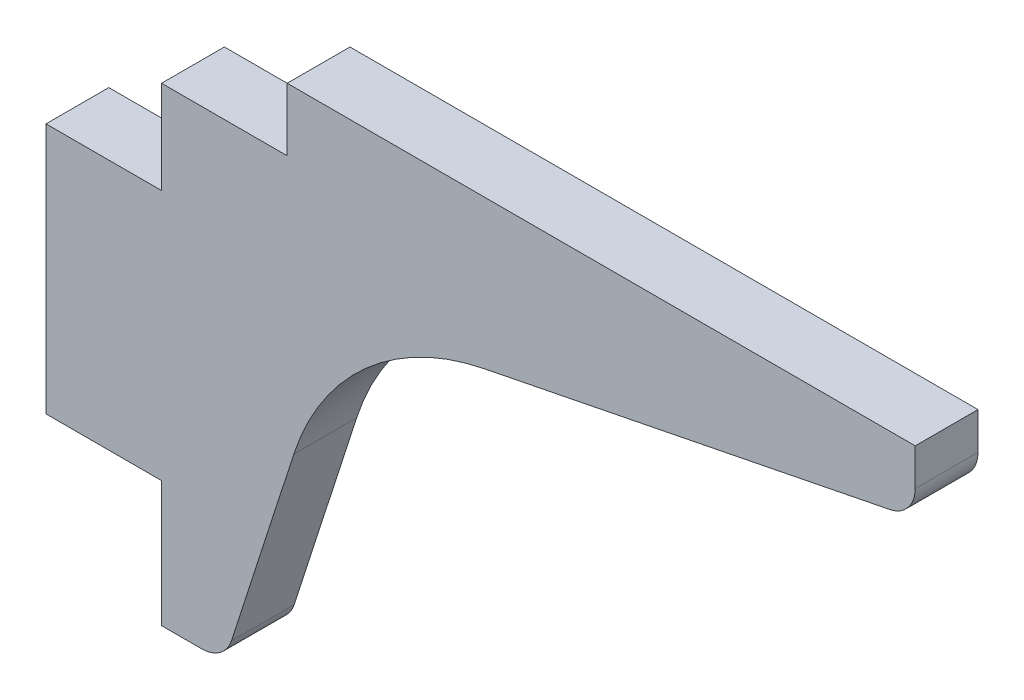
from build123d import *

# Parameters (mm, degrees)
BOSS_EXTRUDE1_DEPTH = 3.175
FILLET1_R           = 12.7
FILLET2_R           = 1.5875


with BuildPart() as part:
    # Sketch1 → Boss-Extrude1 (new body)
    with BuildSketch(Plane.XY):
        Polygon((2.921, 6.35), (2.921, 11.049), (9.271, 11.049), (9.271, 14.224), (41.021, 14.224), (41.021, 11.049), (11.901256121, 5.243743879), (6.096, -12.7), (2.921, -12.7), (2.921, -6.35), (-2.921, -6.35), (-2.921, 6.35), align=None)
    extrude(amount=BOSS_EXTRUDE1_DEPTH)

    # Fillet1
    fillet1_edges = [part.edges().sort_by_distance(p)[0] for p in [
        (11.901256121, 5.243743879, 1.5875),
    ]]
    fillet(fillet1_edges, radius=FILLET1_R)

    # Fillet2
    fillet2_edges = [part.edges().sort_by_distance(p)[0] for p in [
        (41.021, 11.049, 1.5875),
        (6.096, -12.7, 1.5875),
    ]]
    fillet(fillet2_edges, radius=FILLET2_R)


solid = part.part
